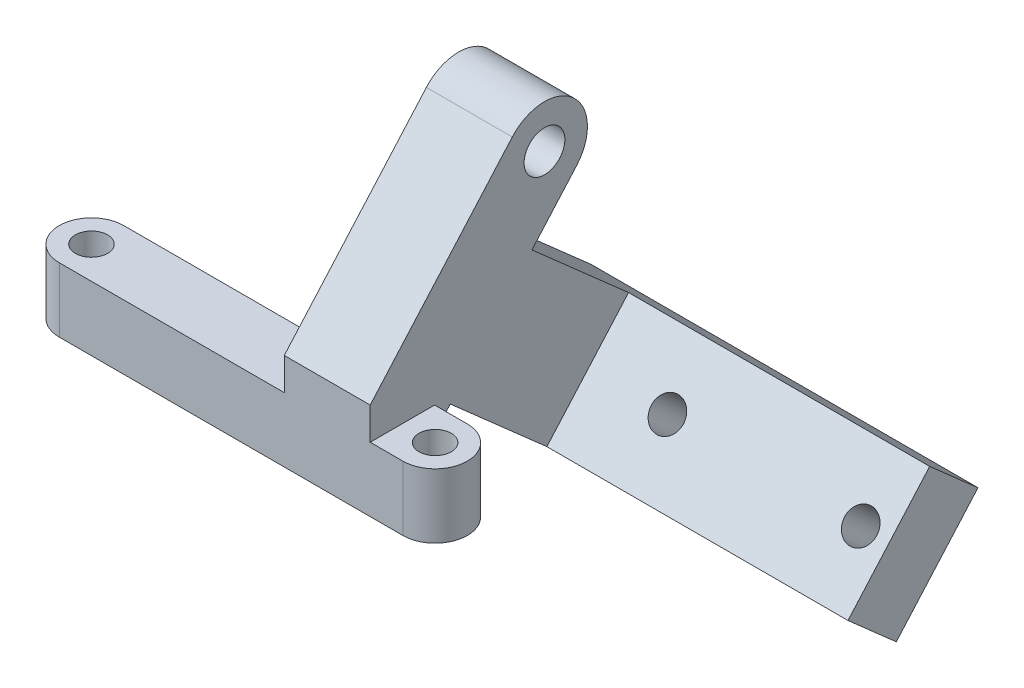
from build123d import *

# Parameters (mm, degrees)
SKETCH_1_R          = 1.5
EXTRUDE_2_DEPTH     = 6
SKETCH_1_4_W        = 8
SKETCH_1_4_H        = 6
EXTRUDE_3_DEPTH     = 3
EXTRUDE_28_DEPTH    = 8
SKETCH_4_W          = 7.960549586
SKETCH_4_H          = 11.5
EXTRUDE_29_DEPTH    = 18
EXTRUDE_30_DEPTH    = 36
SKETCH_8_R          = 1.9
CUT_EXTRUDE_2_DEPTH = 19
SKETCH_7_R          = 1.5
CUT_EXTRUDE_3_DEPTH = 10


with BuildPart() as part:
    # 草圖1 → 填料-伸長2 (new body)
    with BuildSketch(Plane(origin=(0, 0, 0), x_dir=(1, 0, 0), z_dir=(0, 1, 0))):
        with BuildLine():
            Line((-38.676968887, -3), (-6.676968887, -3))
            ThreePointArc((-6.676968887, -3), (-3.676968887, 0), (-6.676968887, 3))
            Line((-6.676968887, 3), (-38.676968887, 3))
            ThreePointArc((-38.676968887, 3), (-41.676968887, 0), (-38.676968887, -3))
        make_face()
        with Locations((-38.676968887, 0)):
            Circle(SKETCH_1_R, mode=Mode.SUBTRACT)
        with Locations((-6.676968887, 0)):
            Circle(SKETCH_1_R, mode=Mode.SUBTRACT)
    extrude(amount=-EXTRUDE_2_DEPTH)

    # 草圖1<4> → 填料-伸長3 (add)
    with BuildSketch(Plane(origin=(0, 0, 0), x_dir=(1, 0, 0), z_dir=(0, 1, 0))):
        with Locations((-13.722758256, 0)):
            Rectangle(SKETCH_1_4_W, SKETCH_1_4_H)
    extrude(amount=EXTRUDE_3_DEPTH)

    # 草圖3 → 填料-伸長28 (add)
    with BuildSketch(Plane(origin=(-9.722758256, 0, 0), x_dir=(0, 0, -1), z_dir=(1, 0, 0))):
        with BuildLine():
            Line((3, -2.291502622), (16.228756555, 12.708497378))
            ThreePointArc((16.228756555, 12.708497378), (15.874507866, 18.354248689), (10.228756555, 18))
            Line((10.228756555, 18), (-3, 3))
            Line((-3, 3), (3, -2.291502622))
        make_face()
    extrude(amount=-EXTRUDE_28_DEPTH)

    # 草圖4 → 填料-伸長29 (add)
    with BuildSketch(Plane(origin=(0, -2.49076751, -2.824264888), x_dir=(-1, 0, 0), z_dir=(0, -0.6614378277661491, -0.7499999999999987))):
        with Locations((13.703033049, 8.211179299)):
            Rectangle(SKETCH_4_W, SKETCH_4_H)
    extrude(amount=EXTRUDE_29_DEPTH)

    # 草圖6 → 填料-伸長30 (add)
    with BuildSketch(Plane.ZY.offset(17.683307842)):
        Polygon((-25.558716996, -3.925763935), (-17.952181977, -12.550763935), (-13.452181977, -8.582136969), (-21.058716996, 0.042863031), align=None)
    extrude(amount=-EXTRUDE_30_DEPTH)

    # 草圖8 → 除料-伸長2 (cut)
    with BuildSketch(Plane(origin=(-9.722758256, 0, 0), x_dir=(0, 0, -1), z_dir=(1, 0, 0))):
        with Locations((13.228756555, 15.354248689)):
            Circle(SKETCH_8_R)
    extrude(amount=-CUT_EXTRUDE_2_DEPTH, mode=Mode.SUBTRACT)

    # 草圖7 → 除料-伸長3 (cut)
    with BuildSketch(Plane(origin=(0, -14.396648409, -16.324264888), x_dir=(-1, 0, 0), z_dir=(0, -0.6614378277661491, -0.7499999999999987))):
        with Locations((2.344835531, 8.278010001)):
            Circle(SKETCH_7_R)
        with Locations((-15.655164469, 8.278010001)):
            Circle(SKETCH_7_R)
    extrude(amount=-CUT_EXTRUDE_3_DEPTH, mode=Mode.SUBTRACT)


solid = part.part
